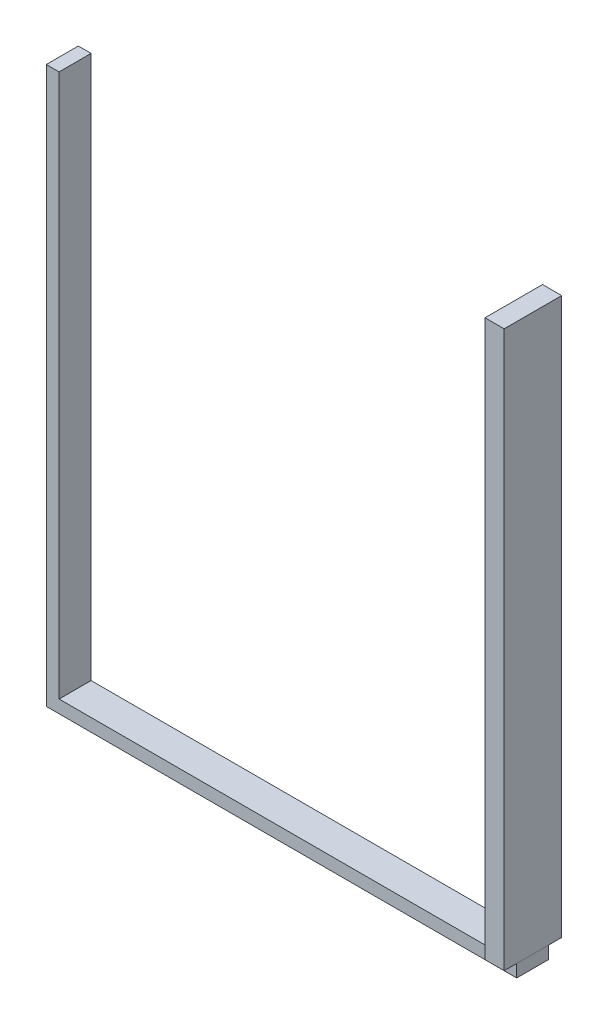
from build123d import *

# Parameters (mm, degrees)
SKETCH1_W           = 4.0005
SKETCH1_H           = 9.99998
BOSS_EXTRUDE1_DEPTH = 173.736
SKETCH2_W           = 9.99998
SKETCH2_H           = 4
BOSS_EXTRUDE2_DEPTH = 143
SKETCH4_W           = 5.979839702
SKETCH4_H           = 17.978619986
BOSS_EXTRUDE3_DEPTH = 173.736


with BuildPart() as part:
    # Sketch1 → Boss-Extrude1 (new body)
    with BuildSketch(Plane(origin=(0, 0, 0), x_dir=(1, 0, 0), z_dir=(0, 1, 0))):
        with Locations((2.00025, 4.99999)):
            Rectangle(SKETCH1_W, SKETCH1_H)
    extrude(amount=BOSS_EXTRUDE1_DEPTH)

    # Sketch2 → Boss-Extrude2 (add)
    with BuildSketch(Plane(origin=(4.0005, 0, 0), x_dir=(0, 0, -1), z_dir=(1, 0, 0))):
        with Locations((4.99999, 2)):
            Rectangle(SKETCH2_W, SKETCH2_H)
    extrude(amount=BOSS_EXTRUDE2_DEPTH)

    # Sketch4 → Boss-Extrude3 (add)
    with BuildSketch(Plane(origin=(0, 4, 0), x_dir=(1, 0, 0), z_dir=(0, 1, 0))):
        with Locations((144.08715059, 4.99814333)):
            Rectangle(SKETCH4_W, SKETCH4_H)
    extrude(amount=BOSS_EXTRUDE3_DEPTH)


solid = part.part
